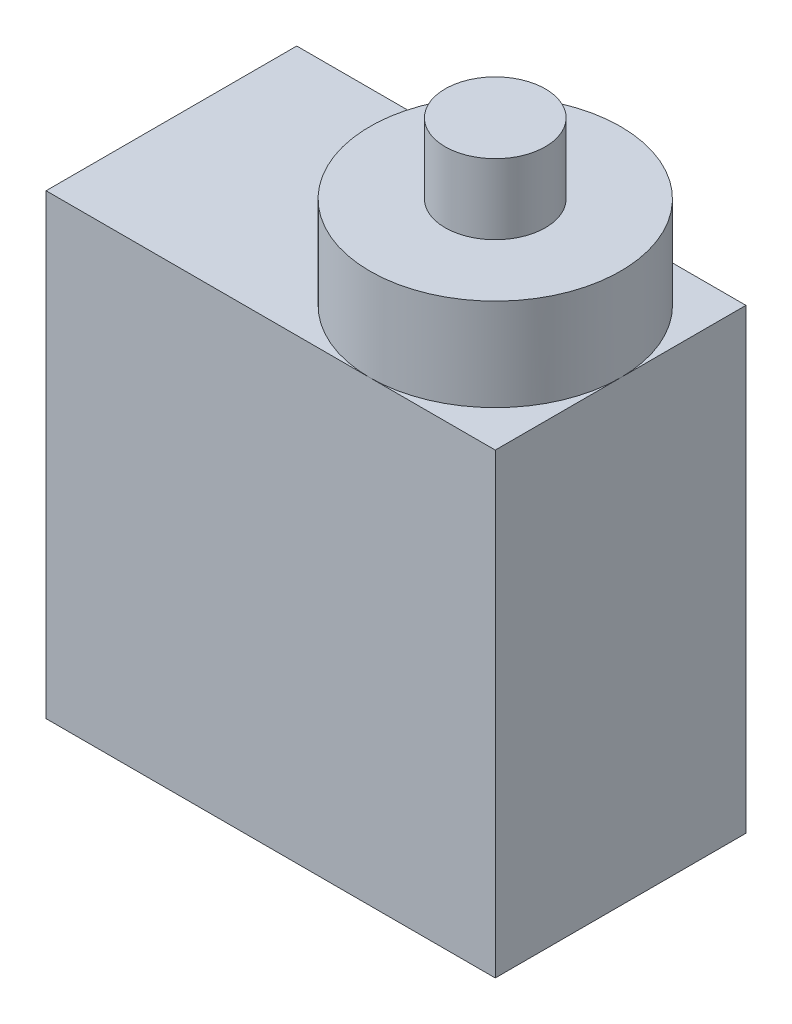
from build123d import *

# Parameters (mm, degrees)
BOSS_EXTRUDE2_DEPTH      = 11.4
BOSS_EXTRUDE2_DEPTH_BACK = 11.4
SKETCH1_W                = 22.4
SKETCH1_H                = 12.5
SKETCH3_R                = 6.25
BOSS_EXTRUDE3_DEPTH      = 4.6
SKETCH4_R                = 2.5
BOSS_EXTRUDE4_DEPTH      = 3.5


with BuildPart() as part:
    # Sketch1 → Boss-Extrude2 (new, two sides: drawn at the far end of the back side and taken through both)
    with BuildSketch(Plane(origin=(0, 0, 0), x_dir=(1, 0, 0), z_dir=(0, 1, 0)).offset(-BOSS_EXTRUDE2_DEPTH_BACK)):
        Rectangle(SKETCH1_W, SKETCH1_H)
    extrude(amount=BOSS_EXTRUDE2_DEPTH + BOSS_EXTRUDE2_DEPTH_BACK)

    # Sketch3 → Boss-Extrude3 (add)
    with BuildSketch(Plane(origin=(0, 11.4, 0), x_dir=(1, 0, 0), z_dir=(0, 1, 0))):
        with Locations((4.95, 0)):
            Circle(SKETCH3_R)
    extrude(amount=BOSS_EXTRUDE3_DEPTH)

    # Sketch4 → Boss-Extrude4 (add)
    with BuildSketch(Plane(origin=(0, 16, 0), x_dir=(1, 0, 0), z_dir=(0, 1, 0))):
        with Locations((4.95, 0)):
            Circle(SKETCH4_R)
    extrude(amount=BOSS_EXTRUDE4_DEPTH)


solid = part.part
